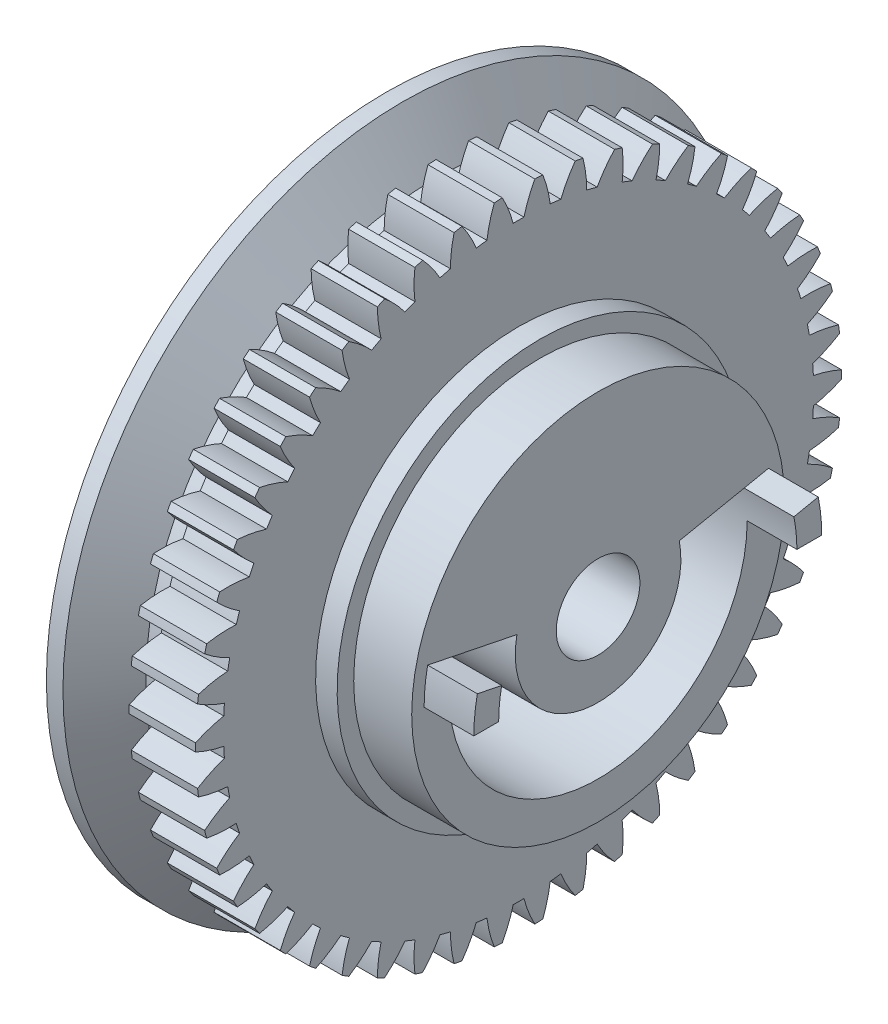
from build123d import *

# Parameters (mm, degrees)
BASPROSKE_W         = 8
BASPROSKE_H         = 39
TOOTHCUT_DEPTH      = 56.731499172
TEETHCUTS_COUNT     = 50
TEETHCUTS_ANGLE     = 352.8
BORSKE_R            = 5
BORE_DEPTH          = 50.0000508
SKETCH_2_R          = 7.5
CUT_EXTRUDE_1_DEPTH = 5.5
SKETCH_10_R         = 5.05
CUT_EXTRUDE_5_DEPTH = 64.382647468
CUT_EXTRUDE_2_DEPTH = 64.382647468
SKETCH_4_R          = 1.1
CUT_EXTRUDE_3_DEPTH = 25.6
CUT_EXTRUDE_START   = -13.6
CUT_EXTRUDE_4_DEPTH = 13.6
EXTRUDE_1_DEPTH     = 6


with BuildPart() as part:
    # BasProSke → Base-Revolve (revolve)
    with BuildSketch(Plane(origin=(0, 0, 0), x_dir=(1, 0, 0), z_dir=(0, 1, 0)), mode=Mode.PRIVATE) as base_revolve_sk:
        with Locations((4, 19.5)):
            Rectangle(BASPROSKE_W, BASPROSKE_H)
    revolve(base_revolve_sk.sketch.rotate(Axis((-10, 0, 0), (1, 0, 0)), 180), axis=Axis((-10, 0, 0), (1, 0, 0)))

    # TooCutSke → ToothCut (cut, through all)
    with BuildSketch(Plane(origin=(0, 0, 0), x_dir=(0, 0, -1), z_dir=(1, 0, 0))):
        with BuildLine():
            ThreePointArc((0.649974317, 35.618069984), (0, 35.624), (-0.649974317, 35.618069984))
            ThreePointArc((-0.649974317, 35.618069984), (-1.213667282, 37.336773562), (-1.980135572, 38.975131921))
            ThreePointArc((-1.980135572, 38.975131921), (0, 39.0254), (1.980135572, 38.975131921))
            ThreePointArc((1.980135572, 38.975131921), (1.213667282, 37.336773562), (0.649974317, 35.618069984))
        make_face()
    toothcut = extrude(amount=TOOTHCUT_DEPTH, mode=Mode.SUBTRACT)

    # TeethCuts: ToothCut ×50 about axis
    teethcuts_axis = Axis((-10, 0, 0), (1, 0, 0))
    for i in range(1, TEETHCUTS_COUNT):
        add(toothcut.rotate(teethcuts_axis, i * TEETHCUTS_ANGLE / (TEETHCUTS_COUNT - 1)), mode=Mode.SUBTRACT)

    # BorSke → Bore (cut, symmetric)
    with BuildSketch(Plane(origin=(0, 0, 0), x_dir=(0, 0, -1), z_dir=(1, 0, 0))):
        with Locations(Location((0, 0, 0), (0, 0, 180))):
            Circle(BORSKE_R)
    extrude(amount=BORE_DEPTH, both=True, mode=Mode.SUBTRACT)

    # 草图1 → 旋转1 (revolve)
    with BuildSketch(Plane.XY):
        Polygon((8, 24.5), (10.6, 24.5), (10.6, 22.5), (17.6, 22.5), (17.6, 5), (8, 5), align=None)
        Polygon((-8, 5), (0, 5), (0, 35), (-2, 35), (-6, 41), (-8, 41), align=None)
    revolve(axis=Axis((0, 0, 0), (-1, 0, 0)))

    # 草图2 → 切除-拉伸1 (cut)
    with BuildSketch(Plane.ZY.offset(8)):
        with Locations(Location((0, 0, 0), (0, 0, 270))):
            Circle(SKETCH_2_R)
    extrude(amount=-CUT_EXTRUDE_1_DEPTH, mode=Mode.SUBTRACT)

    # 草图10 → 切除-拉伸5 (cut, through all)
    with BuildSketch(Plane.ZY.offset(8)):
        with Locations(Location((0, 0, 0), (0, 0, 270))):
            Circle(SKETCH_10_R)
    extrude(amount=-CUT_EXTRUDE_5_DEPTH, mode=Mode.SUBTRACT)

    # 草图3 → 切除-拉伸2 (cut, through all)
    with BuildSketch(Plane.ZY.offset(8)):
        with BuildLine():
            ThreePointArc((-7.5, -6.614378278), (0, -10), (7.5, -6.614378278))
            ThreePointArc((7.5, -6.614378278), (13.145751311, -6.260129589), (13.5, -11.9058809))
            ThreePointArc((13.5, -11.9058809), (0, -18), (-13.5, -11.9058809))
            ThreePointArc((-13.5, -11.9058809), (-13.145751311, -6.260129589), (-7.5, -6.614378278))
        make_face()
    extrude(amount=-CUT_EXTRUDE_2_DEPTH, mode=Mode.SUBTRACT)

    # 草图4 → 切除-拉伸3 (cut)
    with BuildSketch(Plane(origin=(17.6, 0, 0), x_dir=(0, 0, -1), z_dir=(1, 0, 0))):
        with Locations(Location((-14, 0, 0), (0, 0, 90))):
            Circle(SKETCH_4_R)
        with Locations(Location((14, 0, 0), (0, 0, 90))):
            Circle(SKETCH_4_R)
    extrude(amount=-CUT_EXTRUDE_3_DEPTH, mode=Mode.SUBTRACT)

    # 草图5 → 切除-拉伸4 (cut)
    with BuildSketch(Plane(origin=(17.6, 0, 0), x_dir=(0, 0, -1), z_dir=(1, 0, 0)).offset(CUT_EXTRUDE_START)):
        with BuildLine():
            Line((-17.636326148, 3.6), (-9.797958971, 2))
            ThreePointArc((-9.797958971, 2), (0, -10), (9.797958971, 2))
            Line((9.797958971, 2), (17.636326148, 3.6))
            ThreePointArc((17.636326148, 3.6), (0, -18), (-17.636326148, 3.6))
        make_face()
    extrude(amount=CUT_EXTRUDE_4_DEPTH, mode=Mode.SUBTRACT)

    # 草图7 → 凸台-拉伸1 (add)
    with BuildSketch(Plane(origin=(17.6, 0, 0), x_dir=(0, 0, -1), z_dir=(1, 0, 0))):
        with BuildLine():
            ThreePointArc((-18, 0), (-17.908850754, 1.809161316), (-17.636326148, 3.6))
            Line((-17.636326148, 3.6), (-20.575713839, 4.2))
            ThreePointArc((-20.575713839, 4.2), (-20.893659213, 2.110688202), (-21, 0))
            Line((-21, 0), (-18, 0))
        make_face()
        with BuildLine():
            Line((20.575713839, 4.2), (17.636326148, 3.6))
            ThreePointArc((17.636326148, 3.6), (17.908850754, 1.809161316), (18, 0))
            Line((18, 0), (21, 0))
            ThreePointArc((21, 0), (20.893659213, 2.110688202), (20.575713839, 4.2))
        make_face()
    extrude(amount=EXTRUDE_1_DEPTH)


solid = part.part
